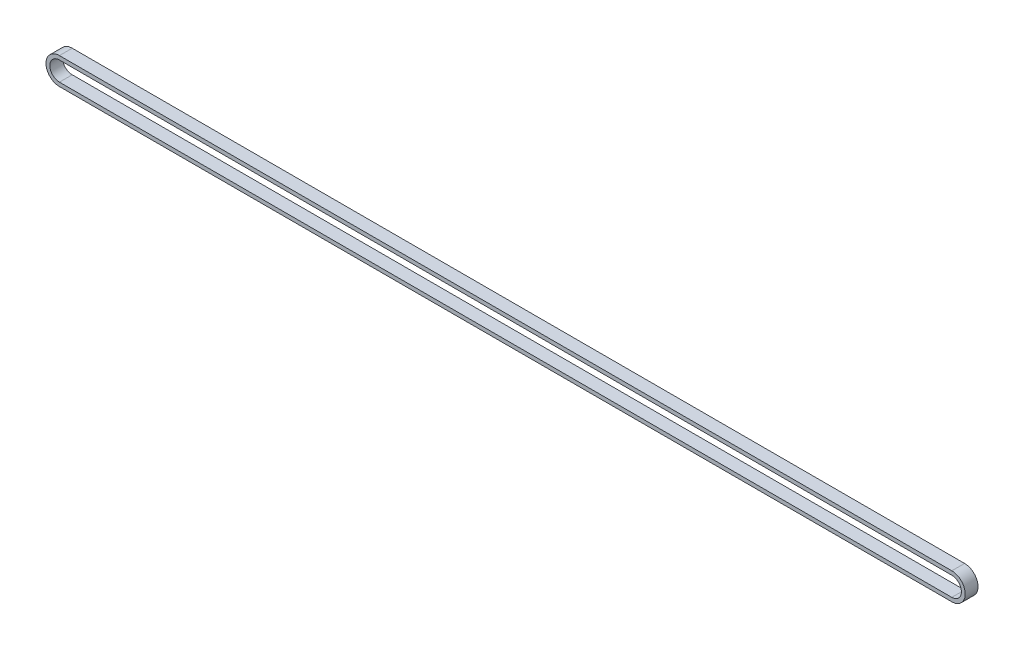
from build123d import *

# Parameters (mm, degrees)
EXTRUDE_THIN1_DEPTH = 6


with BuildPart() as part:
    # Sketch1 → Extrude-Thin1 (new body)
    with BuildSketch(Plane.XY):
        with BuildLine():
            Line((209.395, -6.3), (-209.395, -6.3))
            ThreePointArc((-209.395, -6.3), (-215.695, 0), (-209.395, 6.3))
            Line((-209.395, 6.3), (209.395, 6.3))
            ThreePointArc((209.395, 6.3), (215.695, 0), (209.395, -6.3))
        make_face()
        with BuildLine():
            Line((209.395, -4.5), (-209.395, -4.5))
            ThreePointArc((-209.395, -4.5), (-213.895, 0), (-209.395, 4.5))
            Line((-209.395, 4.5), (209.395, 4.5))
            ThreePointArc((209.395, 4.5), (213.895, 0), (209.395, -4.5))
        make_face(mode=Mode.SUBTRACT)
    extrude(amount=EXTRUDE_THIN1_DEPTH)


solid = part.part
